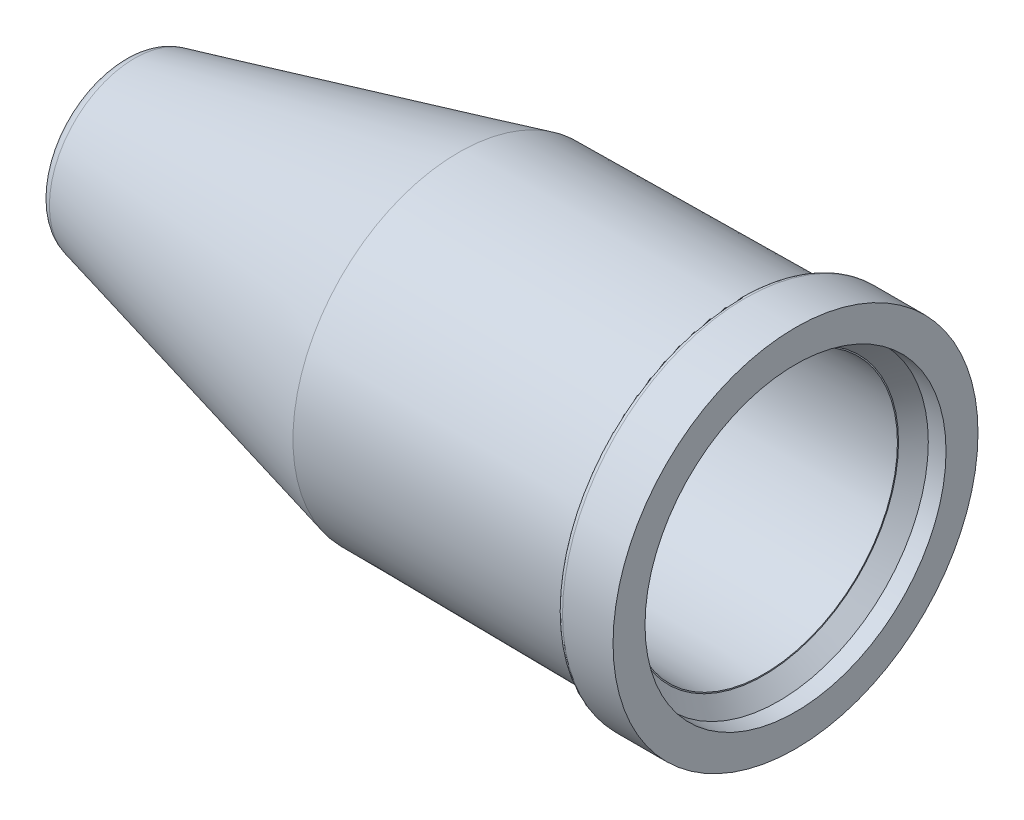
from build123d import *

# Parameters (mm, degrees)
FILLET1_R = 0.3
FILLET2_R = 0.1


with BuildPart() as part:
    # Sketch1 → Base-Revolve (revolve)
    with BuildSketch(Plane.XY, mode=Mode.PRIVATE) as base_revolve_sk:
        with BuildLine():
            Line((0, 2.680722334), (0, 3.25))
            Line((0, 3.25), (-1, 3.25))
            Line((-1, 3.25), (-1, 3))
            Line((-1, 3), (-6, 2.951))
            Line((-6, 2.951), (-12, 1.45996726))
            Line((-12, 1.45996726), (-12, 1.182))
            Line((-12, 1.182), (-11.942216749, 1.182))
            Line((-11.942216749, 1.182), (-11.62665493, 1.112320106))
            ThreePointArc((-11.62665493, 1.112320106), (-11.570254637, 1.077297478), (-11.548216749, 1.014672331))
            Line((-11.548216749, 1.014672331), (-11.548216749, 0.911125))
            Line((-11.548216749, 0.911125), (-7.951168635, 0.862068966))
            ThreePointArc((-7.951168635, 0.862068966), (-7.881136472, 0.832413596), (-7.852216749, 0.762074458))
            Line((-7.852216749, 0.762074458), (-7.852216749, 0.492610835))
            Line((-7.852216749, 0.492610835), (-3.527654115, 0.492610835))
            Line((-3.527654115, 0.492610835), (-2.960346026, 0.4728))
            Line((-2.960346026, 0.4728), (-2.960346026, 0.805509205))
            Line((-2.960346026, 0.805509205), (-3.684186294, 1.068965517))
            Line((-3.684186294, 1.068965517), (-7.28, 1.108374384))
            Line((-7.28, 1.108374384), (-7.28, 1.25))
            Line((-7.28, 1.25), (-7.28, 1.475))
            Line((-7.28, 1.475), (-9.53, 1.475))
            Line((-9.53, 1.475), (-9.53, 1.572428375))
            Line((-9.53, 1.572428375), (-8.071717977, 1.976845772))
            ThreePointArc((-8.071717977, 1.976845772), (-7.759135151, 1.95975844), (-7.5, 2.135397199))
            Line((-7.5, 2.135397199), (-6.81, 2.326751134))
            Line((-6.81, 2.326751134), (-0.565, 2.38))
            Line((-0.565, 2.38), (-0.565, 2.4))
            Line((-0.565, 2.4), (-0.3, 2.665))
            Line((-0.3, 2.665), (0, 2.680722334))
        make_face()
    revolve(base_revolve_sk.sketch.rotate(Axis((3, 0, 0), (-1, 0, 0)), 90), axis=Axis((3, 0, 0), (-1, 0, 0)))

    # Fillet1
    fillet1_edges = [part.edges().sort_by_distance(p)[0] for p in [
        (-12, 0, 1.45996726),
    ]]
    fillet(fillet1_edges, radius=FILLET1_R)

    # Fillet2
    fillet2_edges = [part.edges().sort_by_distance(p)[0] for p in [
        (-1, 0, 3.25),
    ]]
    fillet(fillet2_edges, radius=FILLET2_R)


solid = part.part
